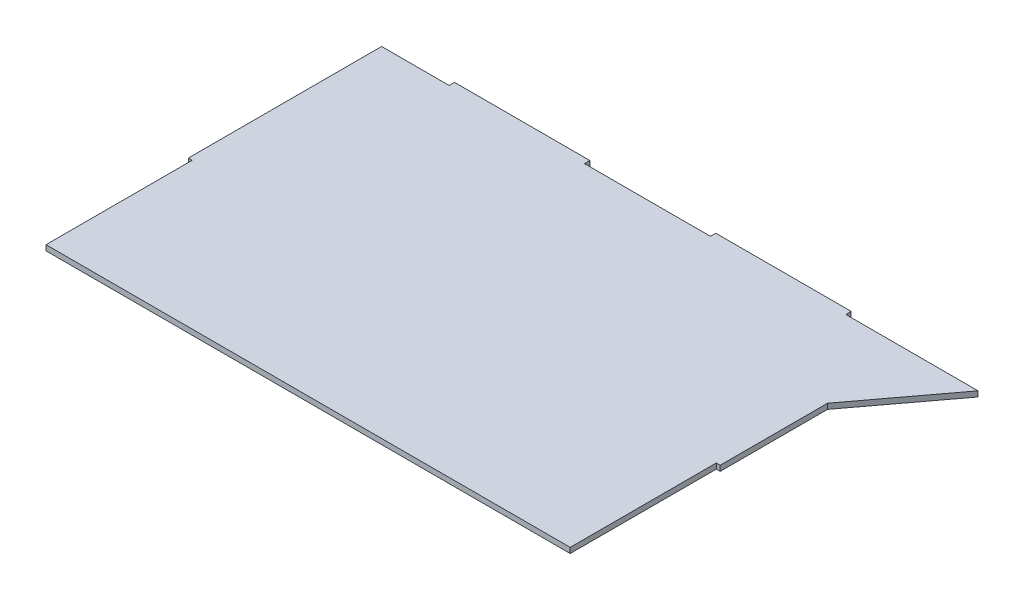
from build123d import *

# Parameters (mm, degrees)
SKETCH1_W           = 314.32961264
SKETCH1_H           = 3.175
BOSS_EXTRUDE1_DEPTH = 200.60000012
CUT_EXTRUDE2_START  = -3.175
SKETCH5_W           = 2.286
SKETCH5_H           = 86.36
CUT_EXTRUDE2_DEPTH  = 259.030286425
SKETCH3_W           = 80
SKETCH3_H           = 3.175
BOSS_EXTRUDE2_DEPTH = 3.175
LPATTERN2_COUNT     = 2
LPATTERN2_PITCH     = 154.43
BOSS_EXTRUDE3_DEPTH = 3.175


with BuildPart() as part:
    # Sketch1 → Boss-Extrude1 (new body)
    with BuildSketch(Plane.XY):
        Rectangle(SKETCH1_W, SKETCH1_H)
    extrude(amount=BOSS_EXTRUDE1_DEPTH)

    # Sketch5 → Cut-Extrude2 (cut)
    with BuildSketch(Plane(origin=(0, 1.5875, 0), x_dir=(1, 0, 0), z_dir=(0, 1, 0)).offset(CUT_EXTRUDE2_START)):
        with Locations((-156.02180632, -157.42000012)):
            Rectangle(SKETCH5_W, SKETCH5_H)
    cut_extrude2 = extrude(amount=CUT_EXTRUDE2_DEPTH, mode=Mode.SUBTRACT)

    # Mirror1: Cut-Extrude2 across plane
    add(cut_extrude2.mirror(Plane(origin=(0, 0, 0), x_dir=(0, 0, 1), z_dir=(1, 0, 0))), mode=Mode.SUBTRACT)

    # Sketch3 → Boss-Extrude2 (add)
    with BuildSketch(Plane(origin=(0, 0, 0), x_dir=(-1, 0, 0), z_dir=(0, 0, -1))):
        with Locations((-77.16480632, 0)):
            Rectangle(SKETCH3_W, SKETCH3_H)
    boss_extrude2 = extrude(amount=BOSS_EXTRUDE2_DEPTH)

    # LPattern2: Boss-Extrude2 ×2
    with Locations(*[(-i * LPATTERN2_PITCH, 0, 0) for i in range(1, LPATTERN2_COUNT)]):
        add(boss_extrude2)

    # Sketch10 → Boss-Extrude3 (add)
    with BuildSketch(Plane.XZ.offset(1.5875)):
        Polygon((157.16480632, 0), (195.26480632, 0), (157.16480632, 50.8), align=None)
    extrude(amount=-BOSS_EXTRUDE3_DEPTH)


solid = part.part
